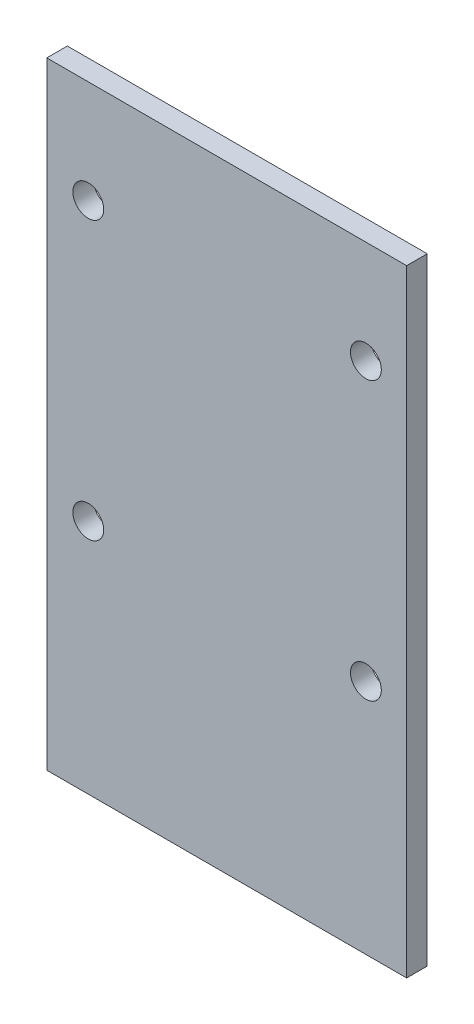
from build123d import *

# Parameters (mm, degrees)
SKETCH1_W           = 35
SKETCH1_H           = 60
BOSS_EXTRUDE1_DEPTH = 2
SKETCH2_R           = 1.5
CUT_EXTRUDE1_DEPTH  = 2


with BuildPart() as part:
    # Sketch1 → Boss-Extrude1 (new body)
    with BuildSketch(Plane.XY):
        Rectangle(SKETCH1_W, SKETCH1_H)
    extrude(amount=BOSS_EXTRUDE1_DEPTH)

    # Sketch2 → Cut-Extrude1 (cut)
    with BuildSketch(Plane.XY.offset(2)):
        with Locations((-13.464295284, 20)):
            Circle(SKETCH2_R)
        with Locations((13.535704716, 20)):
            Circle(SKETCH2_R)
        with Locations((-13.464295284, -7)):
            Circle(SKETCH2_R)
        with Locations((13.535704716, -7)):
            Circle(SKETCH2_R)
    extrude(amount=-CUT_EXTRUDE1_DEPTH, mode=Mode.SUBTRACT)


solid = part.part
